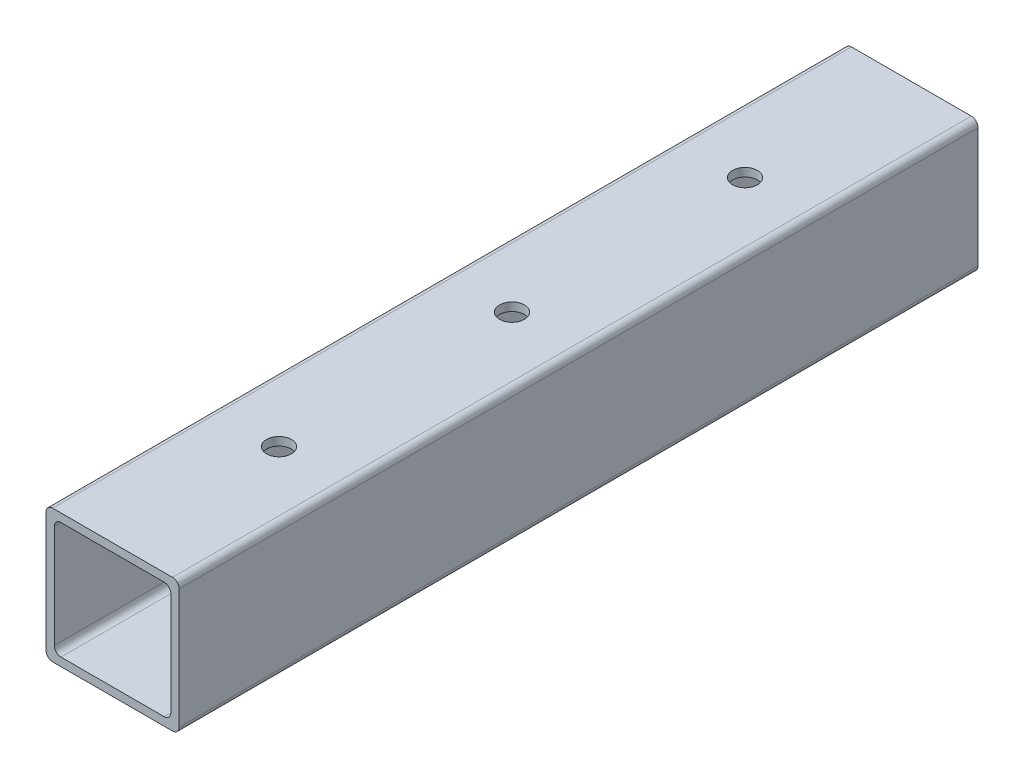
from build123d import *

# Parameters (mm, degrees)
BOSS_EXTRUDE1_DEPTH = 152.4
SKETCH2_R           = 4.7625
CUT_EXTRUDE1_DEPTH  = 76.2


with BuildPart() as part:
    # Sketch1 → Boss-Extrude1 (new, symmetric)
    with BuildSketch(Plane.XY):
        with BuildLine():
            Line((-22.86, -25.4), (22.86, -25.4))
            ThreePointArc((22.86, -25.4), (24.656051224, -24.656051224), (25.4, -22.86))
            Line((25.4, -22.86), (25.4, 22.86))
            ThreePointArc((25.4, 22.86), (24.656051224, 24.656051224), (22.86, 25.4))
            Line((22.86, 25.4), (-22.86, 25.4))
            ThreePointArc((-22.86, 25.4), (-24.656051224, 24.656051224), (-25.4, 22.86))
            Line((-25.4, 22.86), (-25.4, -22.86))
            ThreePointArc((-25.4, -22.86), (-24.656051224, -24.656051224), (-22.86, -25.4))
        make_face()
        with BuildLine():
            Line((-19.685, 22.225), (19.685, 22.225))
            ThreePointArc((19.685, 22.225), (21.481051224, 21.481051224), (22.225, 19.685))
            Line((22.225, 19.685), (22.225, -19.685))
            ThreePointArc((22.225, -19.685), (21.481051224, -21.481051224), (19.685, -22.225))
            Line((19.685, -22.225), (-19.685, -22.225))
            ThreePointArc((-19.685, -22.225), (-21.481051224, -21.481051224), (-22.225, -19.685))
            Line((-22.225, -19.685), (-22.225, 19.685))
            ThreePointArc((-22.225, 19.685), (-21.481051224, 21.481051224), (-19.685, 22.225))
        make_face(mode=Mode.SUBTRACT)
    extrude(amount=BOSS_EXTRUDE1_DEPTH, both=True)

    # Sketch2 → Cut-Extrude1 (cut, symmetric)
    with BuildSketch(Plane(origin=(0, 0, 0), x_dir=(1, 0, 0), z_dir=(0, 1, 0))):
        with Locations(Location((0, 0, 0), (0, 0, 270))):
            Circle(SKETCH2_R)
        with Locations(Location((0, 88.9, 0), (0, 0, 270))):
            Circle(SKETCH2_R)
        with Locations(Location((0, -88.9, 0), (0, 0, 270))):
            Circle(SKETCH2_R)
    extrude(amount=CUT_EXTRUDE1_DEPTH, both=True, mode=Mode.SUBTRACT)


solid = part.part
